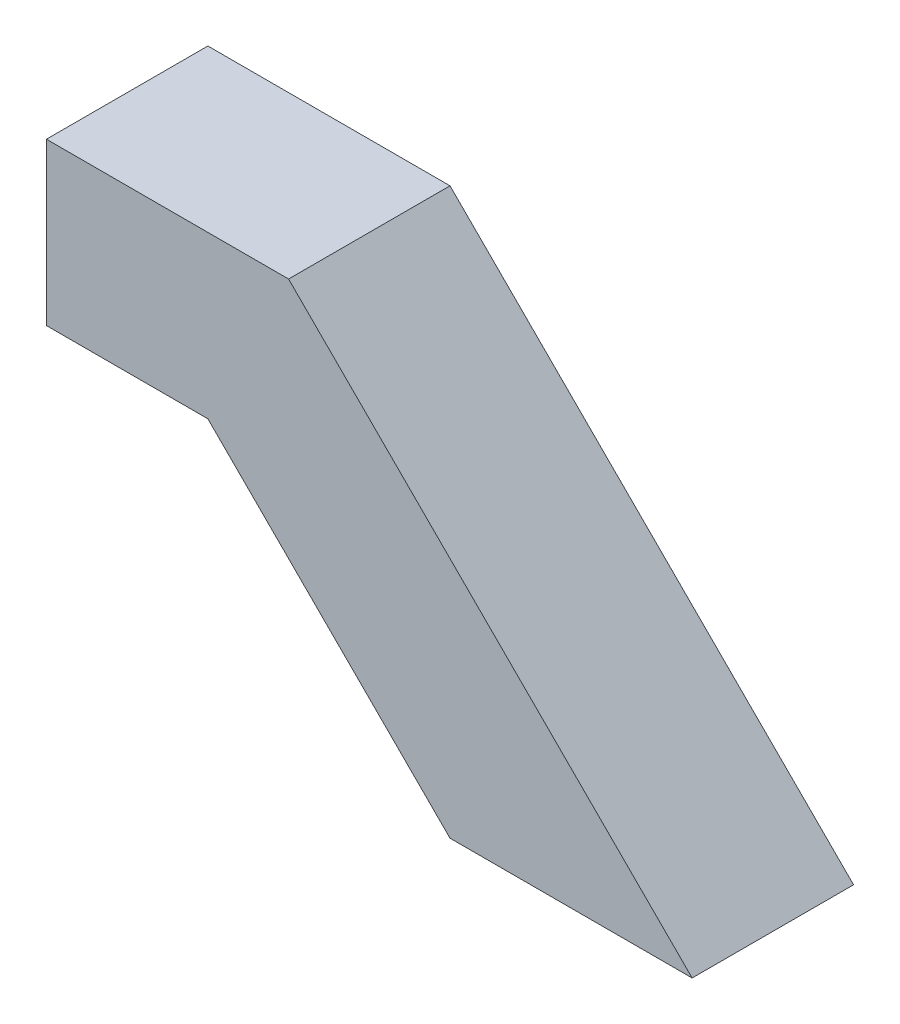
from build123d import *

# Parameters (mm, degrees)
BOSS_EXTRUDE1_DEPTH = 20


with BuildPart() as part:
    # Sketch1 → Boss-Extrude1 (new body)
    with BuildSketch(Plane.XY):
        Polygon((0, 0), (0, 20), (30, 20), (80, -30), (50, -30), (20, 0), align=None)
    extrude(amount=BOSS_EXTRUDE1_DEPTH)


solid = part.part
